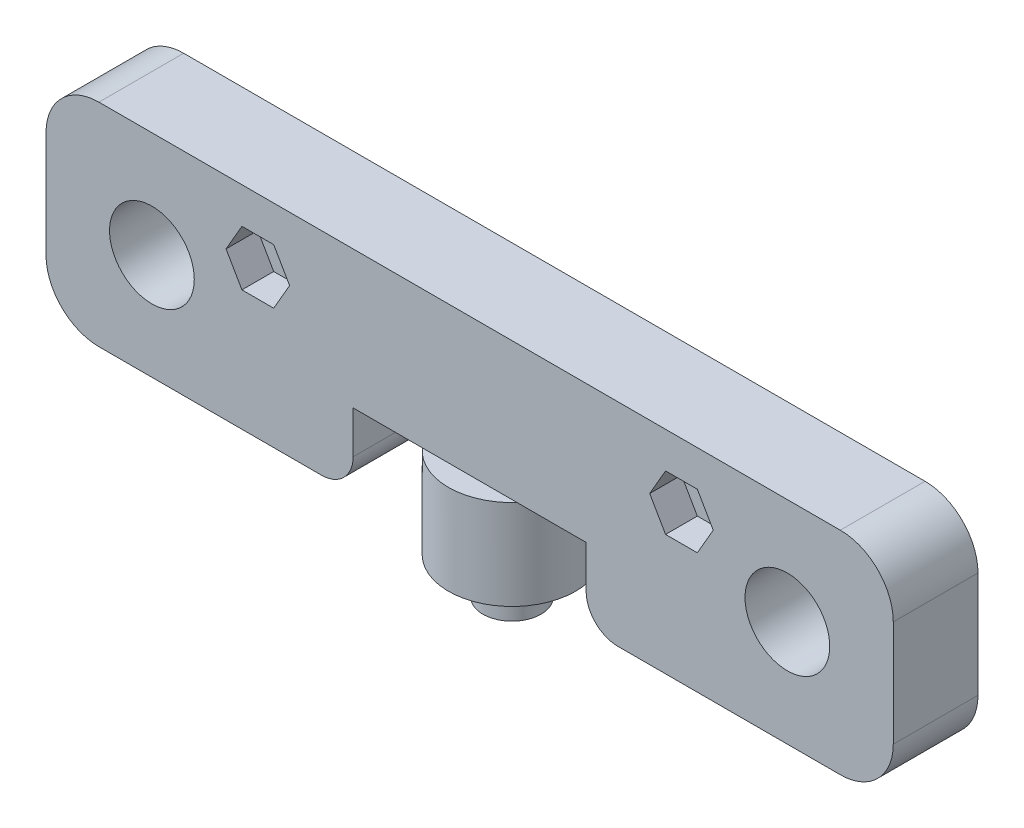
from build123d import *

# Parameters (mm, degrees)
SKETCH1_R                = 4
SKETCH1_R_2              = 1.4
BOSS_EXTRUDE1_DEPTH      = 8
OUTSIDE_CURVES_R         = 5
INSIDE_CURVES_R          = 3
BOLT_HOLES_DEPTH         = 3
SKETCH3_R                = 1.4
BEARING_SCREW_HOLE_DEPTH = 10
SKETCH5_R                = 6
BEARINGS_DEPTH           = 8.5
SKETCH6_R                = 2.75
SCREW_DEPTH              = 3.5


with BuildPart() as part:
    # Sketch1 → Boss-Extrude1 (new body)
    with BuildSketch(Plane.XY):
        Polygon((-11, -3), (-11, -10), (-40, -10), (-40, 10), (40, 10), (40, -10), (11, -10), (11, -3), align=None)
        with Locations((-30, 0)):
            Circle(SKETCH1_R, mode=Mode.SUBTRACT)
        with Locations((-20, 4)):
            Circle(SKETCH1_R_2, mode=Mode.SUBTRACT)
        with Locations(Location((20, 4, 0), (0, 0, 180))):
            Circle(SKETCH1_R_2, mode=Mode.SUBTRACT)
        with Locations(Location((30, 0, 0), (0, 0, 180))):
            Circle(SKETCH1_R, mode=Mode.SUBTRACT)
    extrude(amount=BOSS_EXTRUDE1_DEPTH)

    # outside curves
    outside_curves_edges = [part.edges().sort_by_distance(p)[0] for p in [
        (-40, -10, 4),
        (-40, 10, 4),
        (40, 10, 4),
        (40, -10, 4),
    ]]
    fillet(outside_curves_edges, radius=OUTSIDE_CURVES_R)

    # inside curves
    inside_curves_edges = [part.edges().sort_by_distance(p)[0] for p in [
        (-11, -10, 4),
        (11, -10, 4),
    ]]
    fillet(inside_curves_edges, radius=INSIDE_CURVES_R)

    # Sketch2 → bolt holes (cut)
    with BuildSketch(Plane.XY.offset(8)):
        Polygon((-17, 4), (-18.5, 6.598076211), (-21.5, 6.598076211), (-23, 4), (-21.5, 1.401923789), (-18.5, 1.401923789), align=None)
        Polygon((18.5, 1.401923789), (17, 4), (18.5, 6.598076211), (21.5, 6.598076211), (23, 4), (21.5, 1.401923789), align=None)
    extrude(amount=-BOLT_HOLES_DEPTH, mode=Mode.SUBTRACT)

    # Sketch3 → bearing screw hole (cut)
    with BuildSketch(Plane.XZ.offset(3)):
        with Locations(Location((0, 4, 0), (0, 0, 270))):
            Circle(SKETCH3_R)
    extrude(amount=-BEARING_SCREW_HOLE_DEPTH, mode=Mode.SUBTRACT)

    # Sketch5 → bearings (add)
    with BuildSketch(Plane.XZ.offset(3)):
        with Locations(Location((0, 4, 0), (0, 0, 41.810314896))):
            Circle(SKETCH5_R)
    extrude(amount=BEARINGS_DEPTH)

    # Sketch6 → screw (add)
    with BuildSketch(Plane.XZ.offset(11.5)):
        with Locations(Location((0, 4, 0), (0, 0, 270))):
            Circle(SKETCH6_R)
    extrude(amount=SCREW_DEPTH)


solid = part.part
